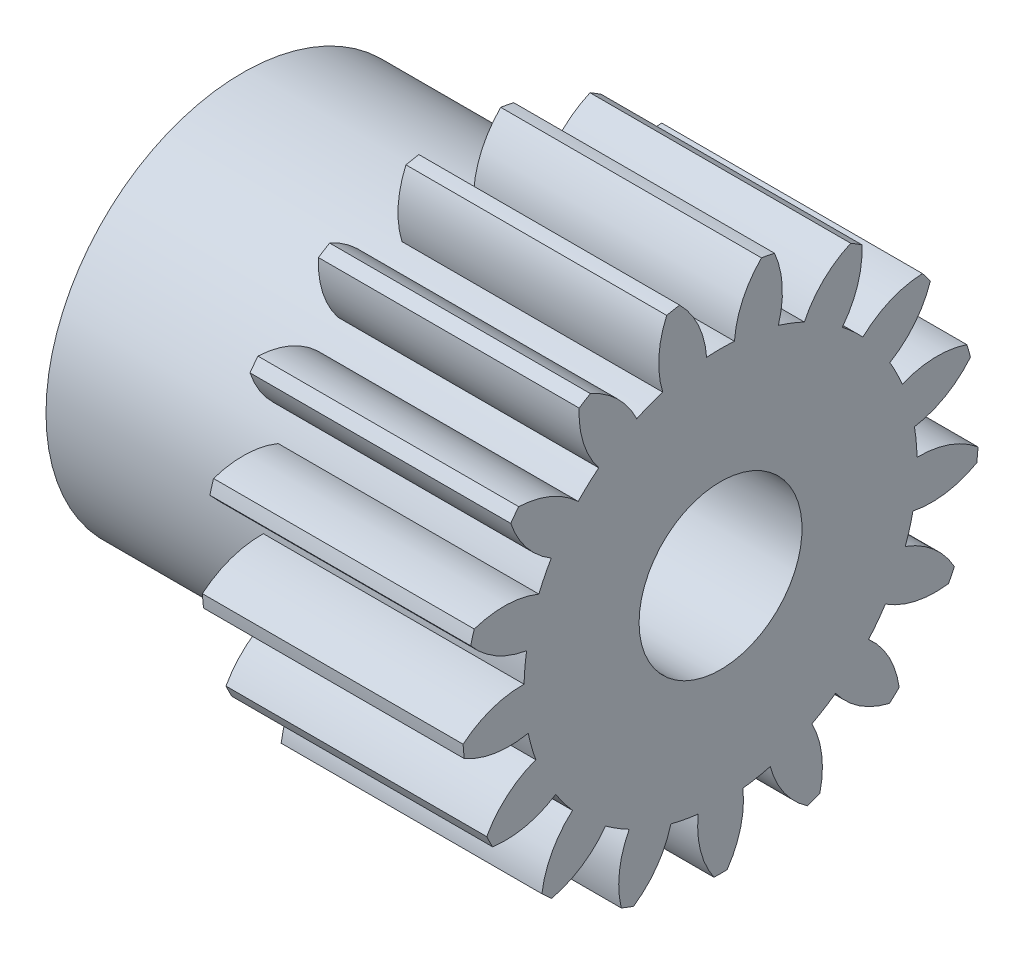
from build123d import *
from build123d.topology import SkipClean

# Parameters (mm, degrees)
BASPROSKE_W      = 7.62
BASPROSKE_H      = 7.540625
TOOTHCUT_DEPTH   = 14.106733032
TEETHCUTS_COUNT  = 17
TEETHCUTS_ANGLE  = 338.823529412
HUBNEARONE_START = 6.3500508
HUBNEAONESKE_R   = 5.743575
HUBNEARONE_DEPTH = 6.3500508
BORSKE_R         = 2.38125
BORE_DEPTH       = 13.9700508


with BuildPart() as part:
    # BasProSke → Base-Revolve (revolve)
    with BuildSketch(Plane(origin=(0, 0, 0), x_dir=(1, 0, 0), z_dir=(0, 1, 0)), mode=Mode.PRIVATE) as base_revolve_sk:
        with Locations((3.81, 3.7703125)):
            Rectangle(BASPROSKE_W, BASPROSKE_H)
    revolve(base_revolve_sk.sketch.rotate(Axis((-10, 0, 0), (1, 0, 0)), 180), axis=Axis((-10, 0, 0), (1, 0, 0)))

    # TooCutSke → ToothCut (cut, through all)
    with BuildSketch(Plane(origin=(0, 0, 0), x_dir=(0, 0, -1), z_dir=(1, 0, 0))):
        with BuildLine():
            ThreePointArc((0.406920963, 5.729142092), (0, 5.743575), (-0.406920963, 5.729142092))
            ThreePointArc((-0.406920963, 5.729142092), (-0.652928085, 6.672737068), (-1.218213807, 7.467308044))
            ThreePointArc((-1.218213807, 7.467308044), (0, 7.566025), (1.218213807, 7.467308044))
            ThreePointArc((1.218213807, 7.467308044), (0.652928085, 6.672737068), (0.406920963, 5.729142092))
        make_face()
    toothcut = extrude(amount=TOOTHCUT_DEPTH, mode=Mode.SUBTRACT)

    # TeethCuts: ToothCut ×17 about axis
    teethcuts_axis = Axis((-10, 0, 0), (1, 0, 0))
    for i in range(1, TEETHCUTS_COUNT):
        add(toothcut.rotate(teethcuts_axis, i * TEETHCUTS_ANGLE / (TEETHCUTS_COUNT - 1)), mode=Mode.SUBTRACT)

    # HubNeaOneSke → HubNearOne (add)
    with SkipClean():  # the faces are left unmerged after this step: merging them gives an invalid solid
        with BuildSketch(Plane.ZY.offset(HUBNEARONE_START)):
            Circle(HUBNEAONESKE_R)
        extrude(amount=-HUBNEARONE_DEPTH)

    # BorSke → Bore (cut, symmetric)
    with SkipClean():  # the faces are left unmerged after this step: merging them gives an invalid solid
        with BuildSketch(Plane(origin=(0, 0, 0), x_dir=(0, 0, -1), z_dir=(1, 0, 0))):
            with Locations(Location((0, 0, 0), (0, 0, 180))):
                Circle(BORSKE_R)
        extrude(amount=BORE_DEPTH, both=True, mode=Mode.SUBTRACT)


solid = part.part
